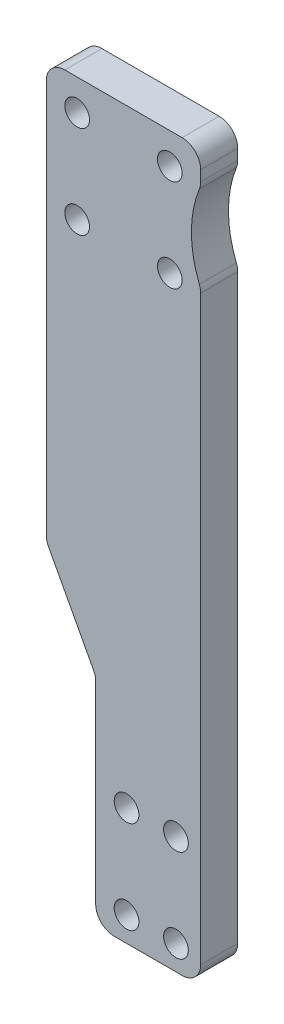
from build123d import *

# Parameters (mm, degrees)
SKETCH_1_R          = 2
EXTRUDE_1_DEPTH     = 6
SKETCH_2_R          = 18
CUT_EXTRUDE_1_DEPTH = 6
SKETCH_3_W          = 2
SKETCH_3_H          = 20
SKETCH_3_W_2        = 23
SKETCH_3_H_2        = 10
CUT_EXTRUDE_2_DEPTH = 10
CUT_EXTRUDE_3_DEPTH = 10
EXTRUDE_2_DEPTH     = 6
SKETCH_6_W          = 15.770181782
SKETCH_6_H          = 14.407317349
EXTRUDE_3_DEPTH     = 6
SKETCH_7_R          = 2
CUT_EXTRUDE_4_DEPTH = 10
FILLET_1_R          = 3
SKETCH_8_R          = 2
CUT_EXTRUDE_5_DEPTH = 10
SKETCH_9_W          = 8
SKETCH_9_H          = 35
CUT_EXTRUDE_6_DEPTH = 10
CUT_EXTRUDE_7_DEPTH = 10
FILLET_2_R          = 3
CHAMFER_2_SIZE      = 2


with BuildPart() as part:
    # 草图1 → 凸台-拉伸1 (new body)
    with BuildSketch(Plane.XY):
        Polygon((12.5, 15), (18, 87.5), (18, 112.5), (-7, 112.5), (-7, 87.5), (-10.5, 15), (-12.5, 15), (-12.5, -15), (12.5, -15), align=None)
        with Locations((7.5, -6)):
            Circle(SKETCH_1_R, mode=Mode.SUBTRACT)
        with Locations((13, 92.5)):
            Circle(SKETCH_1_R, mode=Mode.SUBTRACT)
        with Locations((13, 107.5)):
            Circle(SKETCH_1_R, mode=Mode.SUBTRACT)
        with Locations((-2, 107.5)):
            Circle(SKETCH_1_R, mode=Mode.SUBTRACT)
        with Locations((7.5, 6)):
            Circle(SKETCH_1_R, mode=Mode.SUBTRACT)
        with Locations((-2, 92.5)):
            Circle(SKETCH_1_R, mode=Mode.SUBTRACT)
        with Locations((-0.5, 6)):
            Circle(SKETCH_1_R, mode=Mode.SUBTRACT)
        with Locations((-0.5, -6)):
            Circle(SKETCH_1_R, mode=Mode.SUBTRACT)
    extrude(amount=EXTRUDE_1_DEPTH)

    # 草图2 → 切除-拉伸1 (cut)
    with BuildSketch(Plane.XY.offset(6)):
        with Locations((34.5, 100)):
            Circle(SKETCH_2_R)
    extrude(amount=-CUT_EXTRUDE_1_DEPTH, mode=Mode.SUBTRACT)

    # 草图3 → 切除-拉伸2 (cut)
    with BuildSketch(Plane.XY.offset(6)):
        with Locations((-11.5, 5)):
            Rectangle(SKETCH_3_W, SKETCH_3_H)
        with Locations((1, -10)):
            Rectangle(SKETCH_3_W_2, SKETCH_3_H_2)
        with Locations((-11.5, -10)):
            Rectangle(SKETCH_3_W, SKETCH_3_H_2)
    extrude(amount=-CUT_EXTRUDE_2_DEPTH, mode=Mode.SUBTRACT)

    # 草图4 → 切除-拉伸3 (cut)
    with BuildSketch(Plane.XY.offset(6)):
        Polygon((-7, -5), (-7, 87.5), (-10.5, 15), (-10.5, -5), align=None)
    extrude(amount=-CUT_EXTRUDE_3_DEPTH, mode=Mode.SUBTRACT)

    # 草图5 → 凸台-拉伸2 (add)
    with BuildSketch(Plane.XY.offset(6)):
        Polygon((18, 87.5), (18, -5), (12.5, -5), (12.5, 15), align=None)
    extrude(amount=-EXTRUDE_2_DEPTH)

    # 草图6 → 凸台-拉伸3 (add)
    with BuildSketch(Plane.XY.offset(6)):
        with Locations((3.826559257, 2.203658675)):
            Rectangle(SKETCH_6_W, SKETCH_6_H)
    extrude(amount=-EXTRUDE_3_DEPTH)

    # 草图7 → 切除-拉伸4 (cut)
    with BuildSketch(Plane.XY.offset(6)):
        with Locations((6, -1)):
            Circle(SKETCH_7_R)
        with Locations((6, 14)):
            Circle(SKETCH_7_R)
        with Locations((-2, 14)):
            Circle(SKETCH_7_R)
        with Locations((-2, -1)):
            Circle(SKETCH_7_R)
    extrude(amount=-CUT_EXTRUDE_4_DEPTH, mode=Mode.SUBTRACT)

    # 圆角1
    fillet_1_edges = [part.edges().sort_by_distance(p)[0] for p in [
        (-7, -5, 3),
        (18, -5, 3),
        (-7, 112.5, 3),
        (18, 112.5, 3),
        (18, 107.193747285, 3),
        (18, 92.806252715, 3),
    ]]
    fillet(fillet_1_edges, radius=FILLET_1_R)

    # 草图8 → 切除-拉伸5 (cut)
    with BuildSketch(Plane.XY.offset(6)):
        with Locations((14, 14)):
            Circle(SKETCH_8_R)
        with Locations((14, -1)):
            Circle(SKETCH_8_R)
    extrude(amount=-CUT_EXTRUDE_5_DEPTH, mode=Mode.SUBTRACT)

    # 草图9 → 切除-拉伸6 (cut)
    with BuildSketch(Plane.XY.offset(6)):
        with Locations((-3, 12.5)):
            Rectangle(SKETCH_9_W, SKETCH_9_H)
    extrude(amount=-CUT_EXTRUDE_6_DEPTH, mode=Mode.SUBTRACT)

    # 草图10 → 切除-拉伸7 (cut)
    with BuildSketch(Plane.XY.offset(6)):
        Polygon((1, 30), (-7, 30), (-7, 45), align=None)
    extrude(amount=-CUT_EXTRUDE_7_DEPTH, mode=Mode.SUBTRACT)

    # 圆角2
    fillet_2_edges = [part.edges().sort_by_distance(p)[0] for p in [
        (1, 30, 3),
        (1, -5, 3),
        (-7, 45, 3),
    ]]
    fillet(fillet_2_edges, radius=FILLET_2_R)

    # 倒角2
    chamfer_2_edges = [part.edges().sort_by_distance(p)[0] for p in [
        (-4, 107.5, 0),
        (-4, 92.5, 0),
    ]]
    chamfer(chamfer_2_edges, length=CHAMFER_2_SIZE)


solid = part.part
